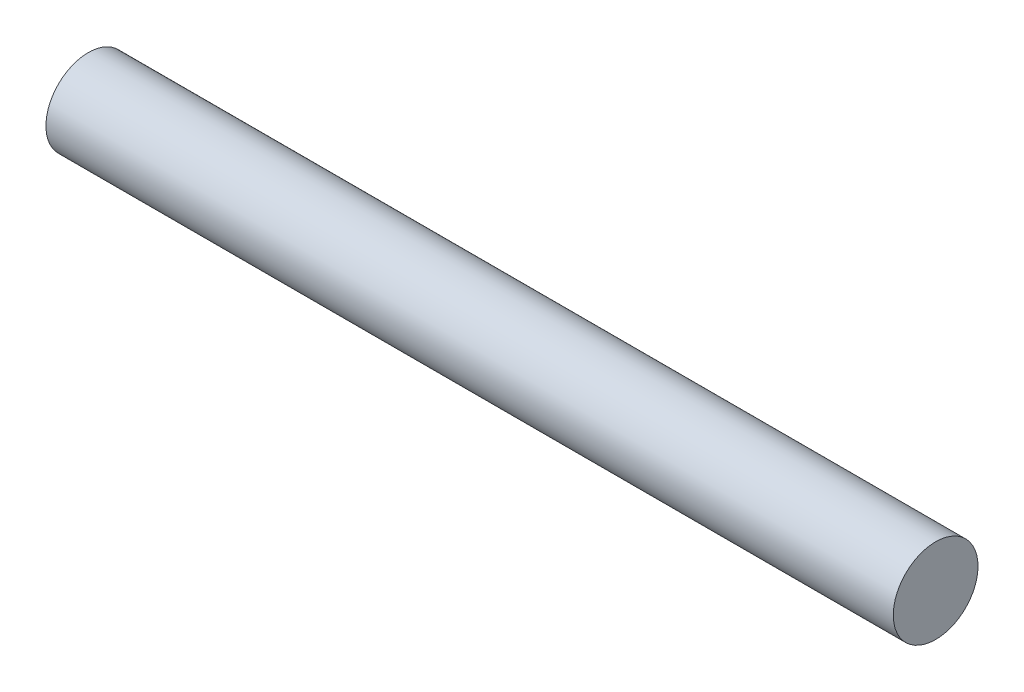
from build123d import *

# Parameters (mm, degrees)
SKETCH1_R           = 6.35
BOSS_EXTRUDE1_DEPTH = 127


with BuildPart() as part:
    # Sketch1 → Boss-Extrude1 (new body)
    with BuildSketch(Plane(origin=(0, 0, 0), x_dir=(0, 0, -1), z_dir=(1, 0, 0))):
        Circle(SKETCH1_R)
    extrude(amount=BOSS_EXTRUDE1_DEPTH)


solid = part.part
